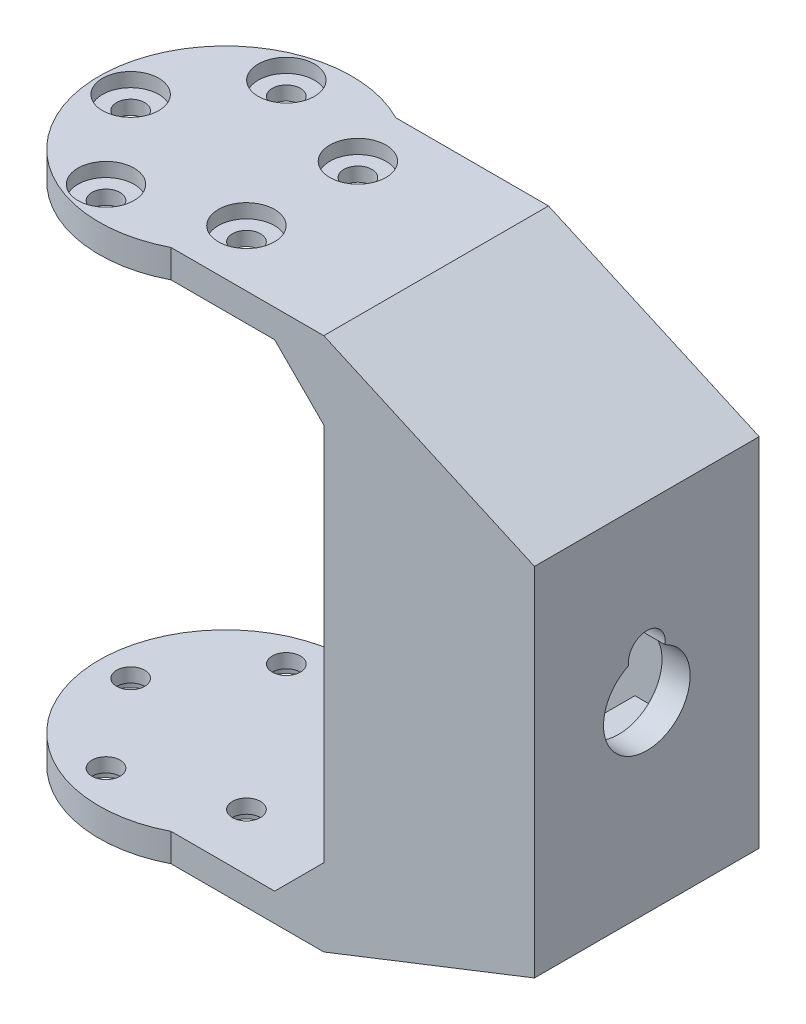
from build123d import *

# Parameters (mm, degrees)
BOSS_EXTRUDE1_DEPTH          = 4
SKETCH2_W                    = 4
SKETCH2_H                    = 32
BOSS_EXTRUDE2_DEPTH          = 72
CUT_EXTRUDE1_DEPTH           = 109.664621658
SKETCH4_W                    = 12.6
SKETCH4_H                    = 4
SKETCH4_W_2                  = 12.599860781
BOSS_EXTRUDE3_DEPTH          = 4
SKETCH5_R                    = 1
CUT_EXTRUDE2_DEPTH           = 4
CUT_EXTRUDE2_DRAFT           = -1
CUT_EXTRUDE2_PROFILE_2_DEPTH = 4
CUT_EXTRUDE2_PROFILE_2_DRAFT = -1
CUT_EXTRUDE4_DEPTH           = 102.980390272
BOSS_EXTRUDE6_DEPTH          = 32
BOSS_EXTRUDE7_DEPTH          = 2
SKETCH14_R                   = 18
SKETCH14_R_2                 = 16
BOSS_EXTRUDE8_DEPTH          = 4
SKETCH15_R                   = 2
CUT_EXTRUDE5_DEPTH           = 4
SKETCH16_R                   = 4
SKETCH16_R_2                 = 2
CUT_EXTRUDE6_DEPTH           = 2
SKETCH17_W                   = 5
SKETCH17_H                   = 10
CUT_EXTRUDE7_DEPTH           = 10
BOSS_EXTRUDE9_DEPTH          = 2
MIRROR6_COPY_1_DEPTH         = 2
FILLET1_R                    = 10
FILLET2_R                    = 10


with BuildPart() as part:
    # Sketch1 → Boss-Extrude1 (new body)
    with BuildSketch(Plane(origin=(0, 0, 0), x_dir=(1, 0, 0), z_dir=(0, 1, 0))):
        with BuildLine():
            Line((0, 16), (60, 16))
            Line((60, 16), (60, -16))
            Line((60, -16), (0, -16))
            ThreePointArc((0, -16), (-16, 0), (0, 16))
        make_face()
    boss_extrude1 = extrude(amount=BOSS_EXTRUDE1_DEPTH)

    # Sketch2 → Boss-Extrude2 (add)
    with BuildSketch(Plane(origin=(0, 4, 0), x_dir=(1, 0, 0), z_dir=(0, 1, 0))):
        with Locations((58, 0)):
            Rectangle(SKETCH2_W, SKETCH2_H)
    extrude(amount=BOSS_EXTRUDE2_DEPTH)

    # Mirror1: Boss-Extrude1 across plane
    add(boss_extrude1.mirror(Plane(origin=(0, 38, 0), x_dir=(0, 0, 1), z_dir=(0, -1, 0))))

    # Sketch3 → Cut-Extrude1 (cut, through all)
    with BuildSketch(Plane(origin=(60, 0, 0), x_dir=(0, 0, -1), z_dir=(1, 0, 0))):
        with BuildLine():
            ThreePointArc((-2.594812436, 43.59757706), (0, 31.830241454), (2.594812436, 43.59757706))
            ThreePointArc((2.594812436, 43.59757706), (0, 46.625832401), (-2.594812436, 43.59757706))
        make_face()
    extrude(amount=-CUT_EXTRUDE1_DEPTH, mode=Mode.SUBTRACT)

    # Sketch4 → Boss-Extrude3 (add)
    with BuildSketch(Plane.ZY.offset(-56)):
        with Locations((0, 57.55)):
            Rectangle(SKETCH4_W, SKETCH4_H)
        with Locations((8.8752e-05, 29.45)):
            Rectangle(SKETCH4_W_2, SKETCH4_H)
    extrude(amount=BOSS_EXTRUDE3_DEPTH)


with BuildPart() as cut_extrude2_tool:
    # Sketch5 → Cut-Extrude2 (with draft: the straight prism first)
    with BuildSketch(Plane.ZY.offset(-52)):
        with Locations((0, 57.275)):
            Circle(SKETCH5_R)
    extrude(amount=-CUT_EXTRUDE2_DEPTH)
    # Cut-Extrude2: the draft: its side faces are tilted about the plane it starts from
    cut_extrude2_sides = [cut_extrude2_tool.faces().sort_by_distance(p)[0] for p in [
        (54, 57.275, -1),
    ]]
    draft(cut_extrude2_sides, Plane.ZY.offset(-52), CUT_EXTRUDE2_DRAFT)


with BuildPart() as part_1:
    add(part.part)

    # Cut-Extrude2: cut by cut_extrude2_tool
    add(cut_extrude2_tool.part, mode=Mode.SUBTRACT)


with BuildPart() as cut_extrude2_profile_2_tool:
    # Sketch5 → Cut-Extrude2 profile 2 (with draft: the straight prism first)
    with BuildSketch(Plane.ZY.offset(-52)):
        with Locations((0.01512814, 29.732868428)):
            Circle(SKETCH5_R)
    extrude(amount=-CUT_EXTRUDE2_PROFILE_2_DEPTH)
    # Cut-Extrude2 profile 2: the draft: its side faces are tilted about the plane it starts from
    cut_extrude2_profile_2_sides = [cut_extrude2_profile_2_tool.faces().sort_by_distance(p)[0] for p in [
        (54, 29.732868428, -0.98487186),
    ]]
    draft(cut_extrude2_profile_2_sides, Plane.ZY.offset(-52), CUT_EXTRUDE2_PROFILE_2_DRAFT)


with BuildPart() as part_2:
    add(part_1.part)

    # Cut-Extrude2 profile 2: cut by cut_extrude2_profile_2_tool
    add(cut_extrude2_profile_2_tool.part, mode=Mode.SUBTRACT)

    # Sketch11 → Cut-Extrude4 (cut, through all)
    with BuildSketch(Plane.XY.offset(16)):
        Polygon((56, 59.55), (30, 72), (30, 76), (60, 76), (60, 59.55), align=None)
        Polygon((60, 0), (60, 14.79), (56, 14.79), (30, 4), (30, 0), align=None)
    extrude(amount=-CUT_EXTRUDE4_DEPTH, mode=Mode.SUBTRACT)


with BuildPart() as cut_extrude4_piece_1:
    # of the separate pieces the step leaves, piece 1, a body of its own (cut_extrude4_pieces)
    add(part_2.part.solids().sort_by_distance((60, 59.55, -16))[0])



with BuildPart() as cut_extrude4_piece_2:
    # of the separate pieces the step leaves, piece 2, a body of its own (cut_extrude4_pieces)
    add(part_2.part.solids().sort_by_distance((0, 0, -16))[0])


with BuildPart() as cut_extrude4_piece_3:
    # of the separate pieces the step leaves, piece 3, a body of its own (cut_extrude4_pieces)
    add(part_2.part.solids().sort_by_distance((0, 76, -16))[0])


with BuildPart() as cut_extrude4_piece_1_1:
    add(cut_extrude4_piece_1.part)

    add(cut_extrude4_piece_2.part)  # Boss-Extrude6 merges Cut-Extrude4 piece 2

    add(cut_extrude4_piece_3.part)  # Boss-Extrude6 merges Cut-Extrude4 piece 3
    # Sketch12 → Boss-Extrude6 (add, through all)
    with BuildSketch(Plane.XY.offset(16)):
        Polygon((30, 72), (56, 59.55), (60, 59.55), (60, 62.55), (30, 76), align=None)
        Polygon((30, 4), (56, 14.79), (60, 14.79), (60, 11.79), (30, 0), align=None)
    extrude(amount=-BOSS_EXTRUDE6_DEPTH)

    # Sketch13 → Boss-Extrude7 (add)
    with BuildSketch(Plane.XY.offset(16)):
        Polygon((30, 76), (30, 0), (60, 11.79), (60, 62.55), align=None)
    boss_extrude7 = extrude(amount=-BOSS_EXTRUDE7_DEPTH)

    # Mirror2: Boss-Extrude7 across plane
    add(boss_extrude7.mirror(Plane.XY))

    # Sketch14 → Boss-Extrude8 (add)
    with BuildSketch(Plane(origin=(0, 76, 0), x_dir=(1, 0, 0), z_dir=(0, 1, 0))):
        Circle(SKETCH14_R)
        Circle(SKETCH14_R_2, mode=Mode.SUBTRACT)
    boss_extrude8 = extrude(amount=-BOSS_EXTRUDE8_DEPTH)

    # Sketch15 → Cut-Extrude5 (cut)
    with BuildSketch(Plane(origin=(0, 76, 0), x_dir=(1, 0, 0), z_dir=(0, 1, 0))):
        with Locations(Location((-13.5, 0, 0), (0, 0, 270))):
            Circle(SKETCH15_R)
        with Locations(Location((-4.171729424, 12.83926297, 0), (0, 0, 270))):
            Circle(SKETCH15_R)
        with Locations(Location((10.921729424, 7.935100906, 0), (0, 0, 270))):
            Circle(SKETCH15_R)
        with Locations(Location((10.921729424, -7.935100906, 0), (0, 0, 270))):
            Circle(SKETCH15_R)
        with Locations(Location((-4.171729424, -12.83926297, 0), (0, 0, 270))):
            Circle(SKETCH15_R)
    cut_extrude5 = extrude(amount=-CUT_EXTRUDE5_DEPTH, mode=Mode.SUBTRACT)

    # Mirror3: Boss-Extrude8, Cut-Extrude5 across plane
    add(boss_extrude8.mirror(Plane(origin=(0, 38, 0), x_dir=(0, 0, 1), z_dir=(0, -1, 0))))
    add(cut_extrude5.mirror(Plane(origin=(0, 38, 0), x_dir=(0, 0, 1), z_dir=(0, -1, 0))), mode=Mode.SUBTRACT)

    # Sketch16 → Cut-Extrude6 (cut)
    # profile 1 of 5: a face of its own
    with BuildSketch(Plane.XZ):
        with Locations(Location((-4.171729424, 12.83926297, 0), (0, 0, 270))):
            Circle(SKETCH16_R)
        with Locations(Location((-4.171729424, 12.83926297, 0), (0, 0, 270))):
            Circle(SKETCH16_R_2, mode=Mode.SUBTRACT)
    # profile 2 of 5: a face of its own
    with BuildSketch(Plane.XZ):
        with Locations(Location((10.921729424, 7.935100906, 0), (0, 0, 270))):
            Circle(SKETCH16_R)
        with Locations(Location((10.921729424, 7.935100906, 0), (0, 0, 270))):
            Circle(SKETCH16_R_2, mode=Mode.SUBTRACT)
    # profile 3 of 5: a face of its own
    with BuildSketch(Plane.XZ):
        with Locations(Location((10.921729424, -7.935100906, 0), (0, 0, 270))):
            Circle(SKETCH16_R)
        with Locations(Location((10.921729424, -7.935100906, 0), (0, 0, 270))):
            Circle(SKETCH16_R_2, mode=Mode.SUBTRACT)
    # profile 4 of 5: a face of its own
    with BuildSketch(Plane.XZ):
        with Locations(Location((-4.171729424, -12.83926297, 0), (0, 0, 270))):
            Circle(SKETCH16_R)
        with Locations(Location((-4.171729424, -12.83926297, 0), (0, 0, 270))):
            Circle(SKETCH16_R_2, mode=Mode.SUBTRACT)
    # profile 5 of 5: a face of its own
    with BuildSketch(Plane.XZ):
        with Locations(Location((-13.5, 0, 0), (0, 0, 270))):
            Circle(SKETCH16_R)
        with Locations(Location((-13.5, 0, 0), (0, 0, 270))):
            Circle(SKETCH16_R_2, mode=Mode.SUBTRACT)
    cut_extrude6 = extrude(amount=-CUT_EXTRUDE6_DEPTH, mode=Mode.SUBTRACT)

    # Mirror4: Cut-Extrude6 across plane
    add(cut_extrude6.mirror(Plane(origin=(0, 38, 0), x_dir=(0, 0, 1), z_dir=(0, -1, 0))), mode=Mode.SUBTRACT)

    # Sketch17 → Cut-Extrude7 (cut)
    with BuildSketch(Plane(origin=(0, 0, -16), x_dir=(-1, 0, 0), z_dir=(0, 0, -1))):
        with Locations((-45, 38)):
            Rectangle(SKETCH17_W, SKETCH17_H)
    extrude(amount=-CUT_EXTRUDE7_DEPTH, mode=Mode.SUBTRACT)

    # Sketch18 → Boss-Extrude9 (add)
    with BuildSketch(Plane(origin=(0, 0, -16), x_dir=(-1, 0, 0), z_dir=(0, 0, -1))):
        Polygon((-30, 11), (-27, 8), (-26, 7), (-23, 4), (-30, 4), align=None)
    boss_extrude9 = extrude(amount=-BOSS_EXTRUDE9_DEPTH)

    # Mirror5: Boss-Extrude9 across plane
    add(boss_extrude9.mirror(Plane.XY))

    # Mirror6: Boss-Extrude9 across plane
    add(boss_extrude9.mirror(Plane(origin=(0, 38, 0), x_dir=(0, 0, 1), z_dir=(0, -1, 0))))

    # Mirror6 copy 1 sketch → Mirror6 copy 1 (add)
    with BuildSketch(Plane(origin=(0, 76, 16), x_dir=(-1, 0, 0), z_dir=(0, 0, 1))):
        Polygon((-30, 11), (-27, 8), (-26, 7), (-23, 4), (-30, 4), align=None)
    extrude(amount=-MIRROR6_COPY_1_DEPTH)

    # Fillet1
    fillet1_edges = [cut_extrude4_piece_1_1.edges().sort_by_distance(p)[0] for p in [
        (30, 72, 0),
    ]]
    fillet(fillet1_edges, radius=FILLET1_R)

    # Fillet2
    fillet2_edges = [cut_extrude4_piece_1_1.edges().sort_by_distance(p)[0] for p in [
        (30, 4, 0),
    ]]
    fillet(fillet2_edges, radius=FILLET2_R)


solid = cut_extrude4_piece_1_1.part
